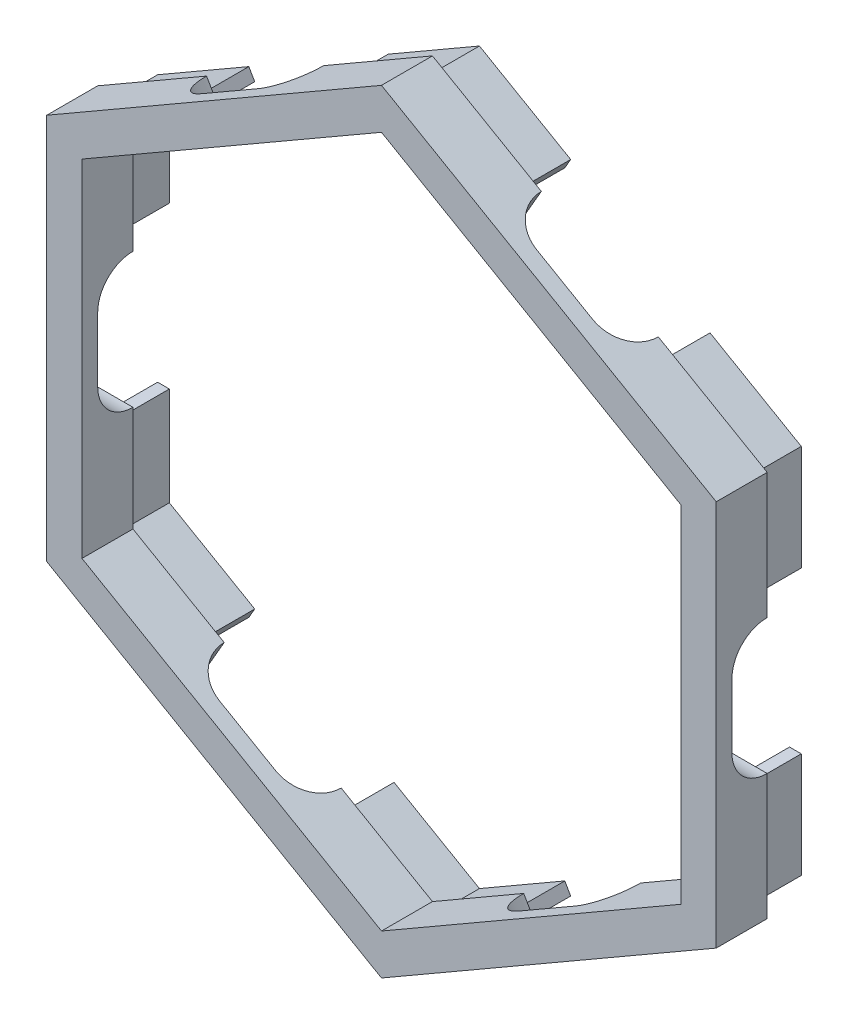
from build123d import *

# Parameters (mm, degrees)
BOSS_EXTRUDE1_DEPTH = 4.34
CUT_EXTRUDE1_DEPTH  = 66.960864154
CUT_EXTRUDE2_REACH  = 73.855
CUT_EXTRUDE3_REACH  = 73.855
BOSS_EXTRUDE2_DEPTH = 4


with BuildPart() as part:
    # Sketch1 → Boss-Extrude1 (new body)
    with BuildSketch(Plane(origin=(0, 0, 0), x_dir=(0, 1, 0), z_dir=(0, 0, 1))):
        Polygon((32.908965344, 0), (16.454482672, 28.5), (-16.454482672, 28.5), (-32.908965344, 0), (-16.454482672, -28.5), (16.454482672, -28.5), align=None)
        Polygon((29.444863729, 0), (14.722431864, 25.5), (-14.722431864, 25.5), (-29.444863729, 0), (-14.722431864, -25.5), (14.722431864, -25.5), align=None, mode=Mode.SUBTRACT)
    extrude(amount=BOSS_EXTRUDE1_DEPTH)

    # Sketch2 → Cut-Extrude1 (cut, through all)
    with BuildSketch(Plane.YZ.offset(28.5)):
        with BuildLine():
            Line((-2.75, 3), (2.75, 3))
            ThreePointArc((2.75, 3), (5.75, 0), (2.75, -3))
            Line((2.75, -3), (-2.75, -3))
            ThreePointArc((-2.75, -3), (-5.75, 0), (-2.75, 3))
        make_face()
    extrude(amount=-CUT_EXTRUDE1_DEPTH, mode=Mode.SUBTRACT)

    # Cut-Extrude2: up to this face of the body (flat: up to its plane)
    cut_extrude2_end = Plane(part.part.faces().sort_by_distance((-14.25, -24.681724008, 2.17))[0])
    # Sketch3 → Cut-Extrude2 (cut, up to the picked face)
    with BuildSketch(Plane(origin=(14.25, 24.681724008, 0), x_dir=(-0.866025403784439, 0.4999999999999994, 0), z_dir=(0.4999999999999994, 0.866025403784439, 0)), mode=Mode.PRIVATE) as cut_extrude2_sk1:
        with BuildLine():
            Line((-2.75, 3), (2.75, 3))
            ThreePointArc((2.75, 3), (5.75, 0), (2.75, -3))
            Line((2.75, -3), (-2.75, -3))
            ThreePointArc((-2.75, -3), (-5.75, 0), (-2.75, 3))
        make_face()
    cut_extrude2_tool1 = split(extrude(cut_extrude2_sk1.sketch, amount=-CUT_EXTRUDE2_REACH, mode=Mode.PRIVATE), bisect_by=cut_extrude2_end, keep=Keep.BOTH, mode=Mode.PRIVATE)
    add(cut_extrude2_tool1.solids().sort_by(Axis((14.25, 24.681724, 0), (-0.4999999999999994, -0.866025403784439, 0)))[0], mode=Mode.SUBTRACT)

    # Cut-Extrude3: up to this face of the body (flat: up to its plane)
    cut_extrude3_end = Plane(part.part.faces().sort_by_distance((14.25, -24.681724008, 2.17))[0])
    # Sketch4 → Cut-Extrude3 (cut, up to the picked face)
    with BuildSketch(Plane(origin=(-14.25, 24.681724008, 0), x_dir=(-0.8660254037844384, -0.5000000000000004, 0), z_dir=(-0.5000000000000004, 0.8660254037844384, 0)), mode=Mode.PRIVATE) as cut_extrude3_sk1:
        with BuildLine():
            Line((-2.75, 3), (2.75, 3))
            ThreePointArc((2.75, 3), (5.75, 0), (2.75, -3))
            Line((2.75, -3), (-2.75, -3))
            ThreePointArc((-2.75, -3), (-5.75, 0), (-2.75, 3))
        make_face()
    cut_extrude3_tool1 = split(extrude(cut_extrude3_sk1.sketch, amount=-CUT_EXTRUDE3_REACH, mode=Mode.PRIVATE), bisect_by=cut_extrude3_end, keep=Keep.BOTH, mode=Mode.PRIVATE)
    add(cut_extrude3_tool1.solids().sort_by(Axis((-14.25, 24.681724, 0), (0.5000000000000004, -0.8660254037844384, 0)))[0], mode=Mode.SUBTRACT)

    # Sketch5 → Boss-Extrude2 (add)
    with BuildSketch(Plane(origin=(0, 0, 0), x_dir=(0, 1, 0), z_dir=(0, 0, 1))):
        Polygon((-20.304096064, 19.632274016), (-19.43807066, 19.132274016), (-15.242047107, 26.4), (-6.85, 26.4), (-6.85, 27.4), (-15.819397376, 27.4), align=None)
        Polygon((20.304096064, 19.632274016), (15.819397376, 27.4), (6.85, 27.4), (6.85, 26.4), (15.242047107, 26.4), (19.43807066, 19.132274016), align=None)
        Polygon((27.154096064, -7.767725984), (31.638794752, 0), (27.154096064, 7.767725984), (26.28807066, 7.267725984), (30.484094213, 0), (26.28807066, -7.267725984), align=None)
        Polygon((6.85, -27.4), (15.819397376, -27.4), (20.304096064, -19.632274016), (19.43807066, -19.132274016), (15.242047107, -26.4), (6.85, -26.4), align=None)
        Polygon((-20.304096064, -19.632274016), (-15.819397376, -27.4), (-6.85, -27.4), (-6.85, -26.4), (-15.242047107, -26.4), (-19.43807066, -19.132274016), align=None)
        Polygon((-27.154096064, 7.767725984), (-31.638794752, 0), (-27.154096064, -7.767725984), (-26.28807066, -7.267725984), (-30.484094213, 0), (-26.28807066, 7.267725984), align=None)
    extrude(amount=-BOSS_EXTRUDE2_DEPTH)


solid = part.part
